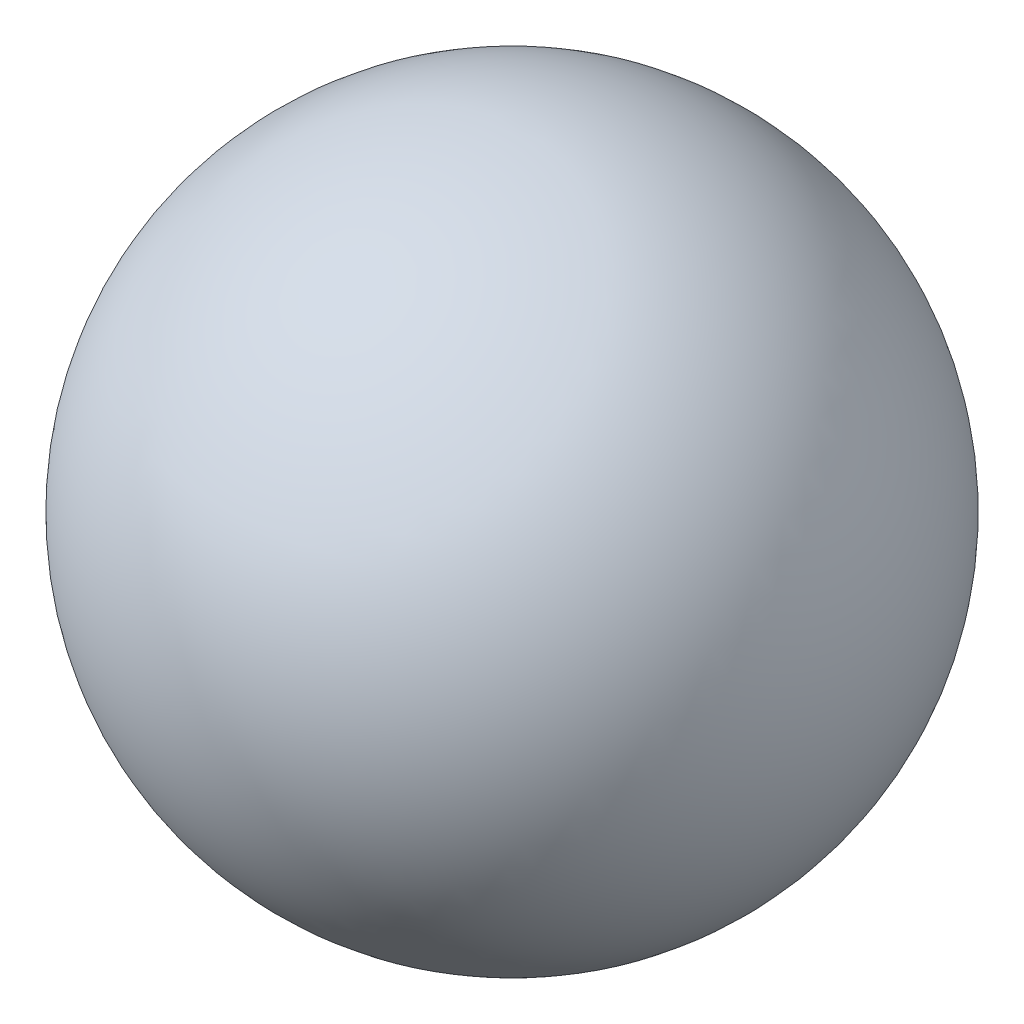
from build123d import *


with BuildPart() as part:
    # 草圖1 → 旋轉1 (revolve)
    with BuildSketch(Plane.XY):
        with BuildLine():
            Line((0, 30), (0, -30))
            ThreePointArc((0, -30), (30, 0), (0, 30))
        make_face()
    revolve(axis=Axis((0, 30, 0), (0, -1, 0)))


solid = part.part
